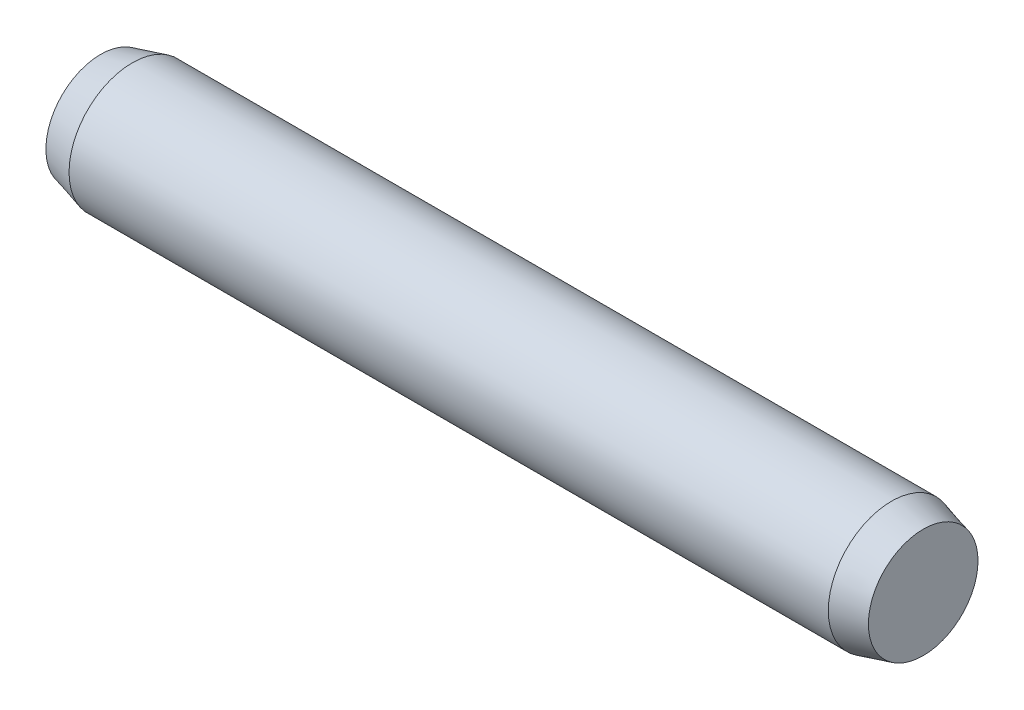
from build123d import *

# Parameters (mm, degrees)
SKETCH_1_R      = 2
EXTRUDE_1_DEPTH = 26
CHAMFER_1_SIZE  = 1
CHAMFER_1_SIZE2 = 0.267949192


with BuildPart() as part:
    # 草图1 → 凸台-拉伸1 (new body)
    with BuildSketch(Plane(origin=(0, 0, 0), x_dir=(0, 0, -1), z_dir=(1, 0, 0))):
        with Locations(Location((0, 0, 0), (0, 0, 180))):
            Circle(SKETCH_1_R)
    extrude(amount=EXTRUDE_1_DEPTH)

    # 倒角1
    chamfer_1_edges = [part.edges().sort_by_distance(p)[0] for p in [
        (0, 0, -2),
        (26, 0, -2),
    ]]
    chamfer_1_side = [part.faces().sort_by_distance(p)[0] for p in [
        (13, 0, -2),
    ]]
    chamfer(chamfer_1_edges, length=CHAMFER_1_SIZE, length2=CHAMFER_1_SIZE2, reference=chamfer_1_side[0])


solid = part.part
